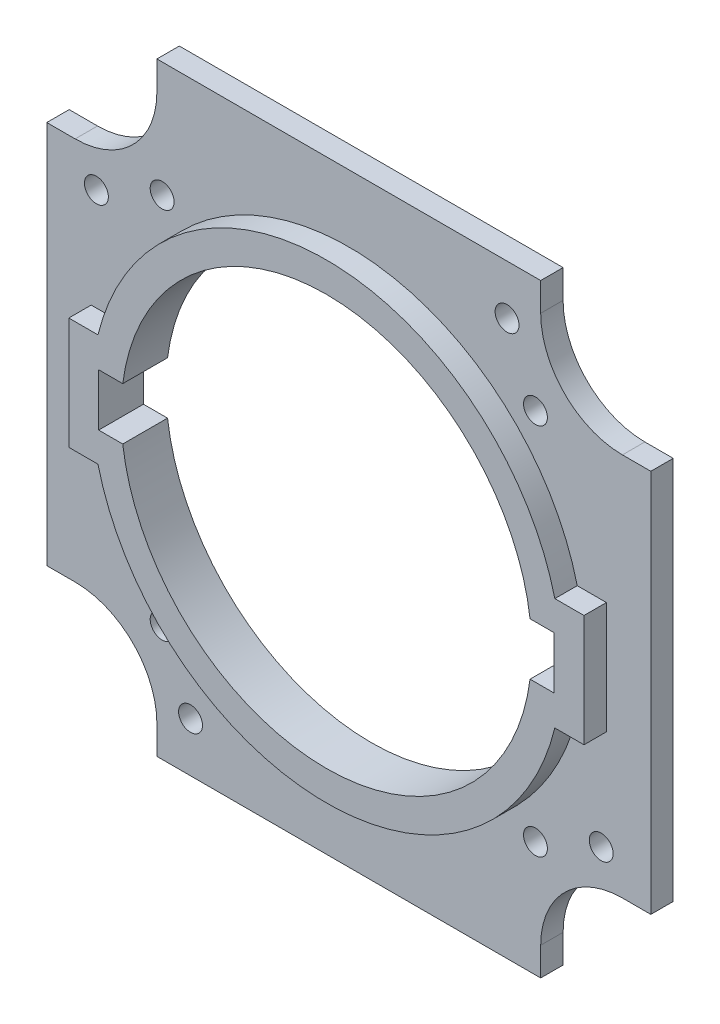
from build123d import *

# Parameters (mm, degrees)
EXTRUDE_1_DEPTH     = 3
CUT_EXTRUDE_2_DEPTH = 62.238264182
SKETCH_7_R          = 1.6
SKETCH_7_R_2        = 27.5
CUT_EXTRUDE_3_DEPTH = 58.283549122
SKETCH_2_R          = 1.6
CUT_EXTRUDE_4_DEPTH = 58.283549122
SKETCH_8_W          = 61
SKETCH_8_H          = 7
CUT_EXTRUDE_5_DEPTH = 58.283549122
EXTRUDE_START       = 3
EXTRUDE_2_DEPTH     = 3


with BuildPart() as part:
    # 草图1 → 凸台-拉伸1 (new body)
    with BuildSketch(Plane.XY):
        with BuildLine():
            Line((-27.5, 43.25), (27.5, 43.25))
            ThreePointArc((27.5, 43.25), (28.207106781, 42.957106781), (28.5, 42.25))
            Line((28.5, 42.25), (28.5, 36.65))
            ThreePointArc((28.5, 36.65), (30.887079733, 30.887079733), (36.65, 28.5))
            Line((36.65, 28.5), (42.25, 28.5))
            ThreePointArc((42.25, 28.5), (42.957106781, 28.207106781), (43.25, 27.5))
            Line((43.25, 27.5), (43.25, -27.5))
            ThreePointArc((43.25, -27.5), (42.957106781, -28.207106781), (42.25, -28.5))
            Line((42.25, -28.5), (36.65, -28.5))
            ThreePointArc((36.65, -28.5), (30.887079733, -30.887079733), (28.5, -36.65))
            Line((28.5, -36.65), (28.5, -42.25))
            ThreePointArc((28.5, -42.25), (28.207106781, -42.957106781), (27.5, -43.25))
            Line((27.5, -43.25), (-27.5, -43.25))
            ThreePointArc((-27.5, -43.25), (-28.207106781, -42.957106781), (-28.5, -42.25))
            Line((-28.5, -42.25), (-28.5, -36.65))
            ThreePointArc((-28.5, -36.65), (-30.887079733, -30.887079733), (-36.65, -28.5))
            Line((-36.65, -28.5), (-42.25, -28.5))
            ThreePointArc((-42.25, -28.5), (-42.957106781, -28.207106781), (-43.25, -27.5))
            Line((-43.25, -27.5), (-43.25, 27.5))
            ThreePointArc((-43.25, 27.5), (-42.957106781, 28.207106781), (-42.25, 28.5))
            Line((-42.25, 28.5), (-36.65, 28.5))
            ThreePointArc((-36.65, 28.5), (-30.887079733, 30.887079733), (-28.5, 36.65))
            Line((-28.5, 36.65), (-28.5, 42.25))
            ThreePointArc((-28.5, 42.25), (-28.207106781, 42.957106781), (-27.5, 43.25))
        make_face()
    extrude(amount=EXTRUDE_1_DEPTH)

    # 草图6 → 切除-拉伸2 (cut, through all)
    with BuildSketch(Plane.XY.offset(3)):
        with BuildLine():
            Line((-28.5, 42.25), (-28.5, 36.65))
            ThreePointArc((-28.5, 36.65), (-30.887079733, 30.887079733), (-36.65, 28.5))
            Line((-36.65, 28.5), (-42.25, 28.5))
            ThreePointArc((-42.25, 28.5), (-42.957106781, 28.207106781), (-43.25, 27.5))
            Line((-43.25, 27.5), (-43.25, -27.5))
            ThreePointArc((-43.25, -27.5), (-42.957106781, -28.207106781), (-42.25, -28.5))
            Line((-42.25, -28.5), (-36.65, -28.5))
            ThreePointArc((-36.65, -28.5), (-30.887079733, -30.887079733), (-28.5, -36.65))
            Line((-28.5, -36.65), (-28.5, -42.25))
            ThreePointArc((-28.5, -42.25), (-28.207106781, -42.957106781), (-27.5, -43.25))
            Line((-27.5, -43.25), (27.5, -43.25))
            ThreePointArc((27.5, -43.25), (28.207106781, -42.957106781), (28.5, -42.25))
            Line((28.5, -42.25), (28.5, -36.65))
            ThreePointArc((28.5, -36.65), (30.887079733, -30.887079733), (36.65, -28.5))
            Line((36.65, -28.5), (42.25, -28.5))
            ThreePointArc((42.25, -28.5), (42.957106781, -28.207106781), (43.25, -27.5))
            Line((43.25, -27.5), (43.25, 27.5))
            ThreePointArc((43.25, 27.5), (42.957106781, 28.207106781), (42.25, 28.5))
            Line((42.25, 28.5), (36.65, 28.5))
            ThreePointArc((36.65, 28.5), (30.887079733, 30.887079733), (28.5, 36.65))
            Line((28.5, 36.65), (28.5, 42.25))
            ThreePointArc((28.5, 42.25), (28.207106781, 42.957106781), (27.5, 43.25))
            Line((27.5, 43.25), (-27.5, 43.25))
            ThreePointArc((-27.5, 43.25), (-28.207106781, 42.957106781), (-28.5, 42.25))
        make_face()
        with BuildLine():
            Line((-25.7, 40.45), (-25.7, 36.65))
            ThreePointArc((-25.7, 36.65), (-28.907180746, 28.907180746), (-36.65, 25.7))
            Line((-36.65, 25.7), (-40.45, 25.7))
            Line((-40.45, 25.7), (-40.45, -25.7))
            Line((-40.45, -25.7), (-36.65, -25.7))
            ThreePointArc((-36.65, -25.7), (-28.907180746, -28.907180746), (-25.7, -36.65))
            Line((-25.7, -36.65), (-25.7, -40.45))
            Line((-25.7, -40.45), (25.7, -40.45))
            Line((25.7, -40.45), (25.7, -36.65))
            ThreePointArc((25.7, -36.65), (28.907180746, -28.907180746), (36.65, -25.7))
            Line((36.65, -25.7), (40.45, -25.7))
            Line((40.45, -25.7), (40.45, 25.7))
            Line((40.45, 25.7), (36.65, 25.7))
            ThreePointArc((36.65, 25.7), (28.907180746, 28.907180746), (25.7, 36.65))
            Line((25.7, 36.65), (25.7, 40.45))
            Line((25.7, 40.45), (-25.7, 40.45))
        make_face(mode=Mode.SUBTRACT)
    extrude(amount=-CUT_EXTRUDE_2_DEPTH, mode=Mode.SUBTRACT)

    # 草图7 → 切除-拉伸3 (cut, through all)
    with BuildSketch(Plane.XY.offset(3)):
        with Locations((-25, 25)):
            Circle(SKETCH_7_R)
        with Locations((25, 25)):
            Circle(SKETCH_7_R)
        with Locations((25, -25)):
            Circle(SKETCH_7_R)
        with Locations((-25, -25)):
            Circle(SKETCH_7_R)
        Circle(SKETCH_7_R_2)
    extrude(amount=-CUT_EXTRUDE_3_DEPTH, mode=Mode.SUBTRACT)

    # 草图2 → 切除-拉伸4 (cut, through all)
    with BuildSketch(Plane.XY.offset(3)):
        with Locations((-33.80515662, 21.19484338)):
            Circle(SKETCH_2_R)
        with Locations((21.19484338, 33.80515662)):
            Circle(SKETCH_2_R)
        with Locations((33.80515662, -21.19484338)):
            Circle(SKETCH_2_R)
        with Locations((-21.19484338, -33.80515662)):
            Circle(SKETCH_2_R)
    extrude(amount=-CUT_EXTRUDE_4_DEPTH, mode=Mode.SUBTRACT)

    # 草图8 → 切除-拉伸5 (cut, through all)
    with BuildSketch(Plane.XY.offset(3)):
        Rectangle(SKETCH_8_W, SKETCH_8_H)
    extrude(amount=-CUT_EXTRUDE_5_DEPTH, mode=Mode.SUBTRACT)

    # 草图9 → 凸台-拉伸2 (add)
    with BuildSketch(Plane.XY.offset(3).offset(EXTRUDE_START)):
        with BuildLine():
            Line((-34.5, -7.5), (-30.594117082, -7.5))
            ThreePointArc((-30.594117082, -7.5), (0, -31.5), (30.594117082, -7.5))
            Line((30.594117082, -7.5), (34.5, -7.5))
            Line((34.5, -7.5), (34.5, 7.5))
            Line((34.5, 7.5), (30.594117082, 7.5))
            ThreePointArc((30.594117082, 7.5), (0, 31.5), (-30.594117082, 7.5))
            Line((-30.594117082, 7.5), (-34.5, 7.5))
            Line((-34.5, 7.5), (-34.5, -7.5))
        make_face()
        with BuildLine():
            Line((-30.5, -3.5), (-27.276363394, -3.5))
            ThreePointArc((-27.276363394, -3.5), (0, -27.5), (27.276363394, -3.5))
            Line((27.276363394, -3.5), (30.5, -3.5))
            Line((30.5, -3.5), (30.5, 3.5))
            Line((30.5, 3.5), (27.276363394, 3.5))
            ThreePointArc((27.276363394, 3.5), (0, 27.5), (-27.276363394, 3.5))
            Line((-27.276363394, 3.5), (-30.5, 3.5))
            Line((-30.5, 3.5), (-30.5, -3.5))
        make_face(mode=Mode.SUBTRACT)
    extrude(amount=-EXTRUDE_2_DEPTH)


solid = part.part
